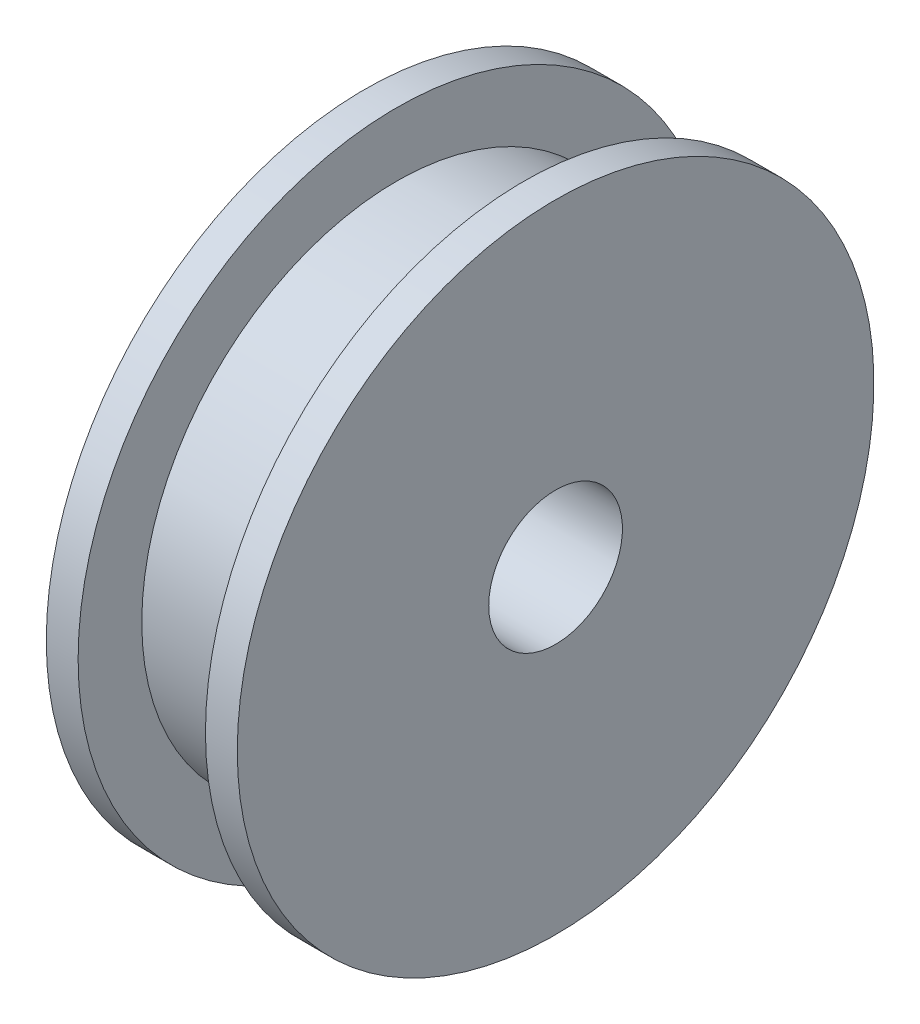
from build123d import *


with BuildPart() as part:
    # Esboço1 → Revolução2 (revolve)
    with BuildSketch(Plane.XY, mode=Mode.PRIVATE) as revolu_o2_sk:
        Polygon((1.5, 5), (1.5, 1.05), (-1.5, 1.05), (-1.5, 5), (-1, 5), (-1, 4), (1, 4), (1, 5), align=None)
    revolve(revolu_o2_sk.sketch.rotate(Axis((0, 0, 0), (1, 0, 0)), 90), axis=Axis((0, 0, 0), (1, 0, 0)))


solid = part.part
